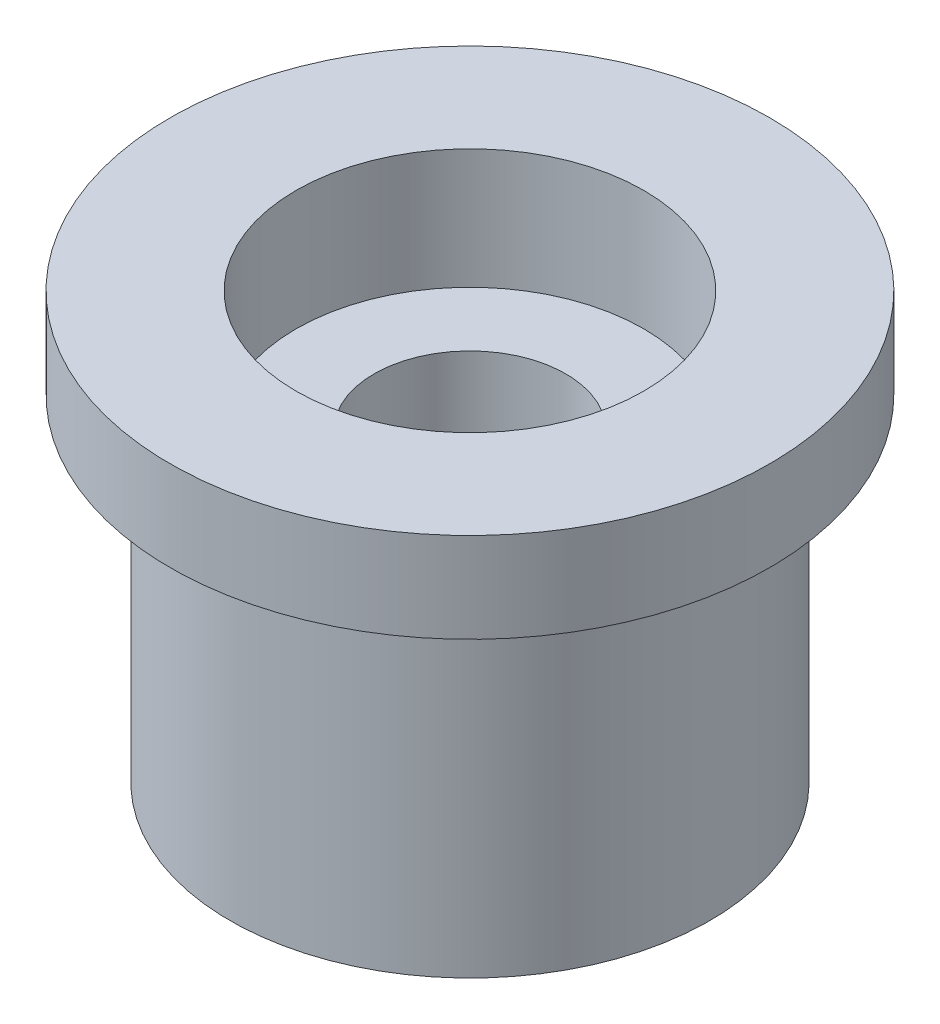
from build123d import *

# Parameters (mm, degrees)
ESQUISSE1_W                                        = 5
ESQUISSE1_H                                        = 1.5
ESQUISSE2_R                                        = 4
BOSS_EXTRU_1_DEPTH                                 = 5.6
ENL_V_MAT_EXTRU_1_DEPTH                            = 4.3
ENL_V_MAT_EXTRU_2_DEPTH                            = 4.3
ENL_V_MAT_EXTRU_3_DEPTH                            = 4.3
CHAMBRAGE_POUR_VIS_T_TE_HEXAGONALE_M31_D           = 3.2
CHAMBRAGE_POUR_VIS_T_TE_HEXAGONALE_M31_CBORE_D     = 5.8
CHAMBRAGE_POUR_VIS_T_TE_HEXAGONALE_M31_CBORE_DEPTH = 2


with BuildPart() as part:
    # Esquisse1 → Révolution1 (revolve)
    with BuildSketch(Plane.XY, mode=Mode.PRIVATE) as r_volution1_sk:
        with Locations((2.5, 6.35)):
            Rectangle(ESQUISSE1_W, ESQUISSE1_H)
    revolve(r_volution1_sk.sketch.rotate(Axis((0, 7.1, 0), (0, -1, 0)), 270), axis=Axis((0, 7.1, 0), (0, -1, 0)))

    # Esquisse2 → Boss.-Extru.1 (add)
    with BuildSketch(Plane.XZ.offset(-5.6)):
        with Locations(Location((0, 0, 0), (0, 0, 270))):
            Circle(ESQUISSE2_R)
    extrude(amount=BOSS_EXTRU_1_DEPTH)

    # Esquisse3 → Enlèv. mat.-Extru.1 (cut)
    with BuildSketch(Plane.XZ):
        with BuildLine():
            Line((-1.190632453, 2.862235902), (-0.786065004, 2.161504525))
            ThreePointArc((-0.786065004, 2.161504525), (1.15, 1.991858429), (2.264950331, 0.4))
            Line((2.264950331, 0.4), (3.07408523, 0.4))
            ThreePointArc((3.07408523, 0.4), (1.55, 2.684678752), (-1.190632453, 2.862235902))
        make_face()
    extrude(amount=-ENL_V_MAT_EXTRU_1_DEPTH, mode=Mode.SUBTRACT)

    # Esquisse4 → Enlèv. mat.-Extru.2 (cut)
    with BuildSketch(Plane.XZ):
        with BuildLine():
            Line((-0.786065004, -2.161504525), (-1.190632453, -2.862235902))
            ThreePointArc((-1.190632453, -2.862235902), (1.55, -2.684678752), (3.07408523, -0.4))
            Line((3.07408523, -0.4), (2.264950331, -0.4))
            ThreePointArc((2.264950331, -0.4), (1.15, -1.991858429), (-0.786065004, -2.161504525))
        make_face()
    extrude(amount=-ENL_V_MAT_EXTRU_2_DEPTH, mode=Mode.SUBTRACT)

    # Esquisse5 → Enlèv. mat.-Extru.3 (cut)
    with BuildSketch(Plane.XZ):
        with BuildLine():
            Line((-1.883452776, -2.462235902), (-1.478885327, -1.761504525))
            ThreePointArc((-1.478885327, -1.761504525), (-2.3, 0), (-1.478885327, 1.761504525))
            Line((-1.478885327, 1.761504525), (-1.883452776, 2.462235902))
            ThreePointArc((-1.883452776, 2.462235902), (-3.1, 0), (-1.883452776, -2.462235902))
        make_face()
    extrude(amount=-ENL_V_MAT_EXTRU_3_DEPTH, mode=Mode.SUBTRACT)

    # Chambrage pour vis à tête hexagonale M31 (through all)
    with Locations(Plane(origin=(0, 7.1, 0), x_dir=(1, 0, 0), z_dir=(0, 1, 0))):
        with Locations((0, 0)):
            CounterBoreHole(CHAMBRAGE_POUR_VIS_T_TE_HEXAGONALE_M31_D / 2, CHAMBRAGE_POUR_VIS_T_TE_HEXAGONALE_M31_CBORE_D / 2, CHAMBRAGE_POUR_VIS_T_TE_HEXAGONALE_M31_CBORE_DEPTH)


solid = part.part
